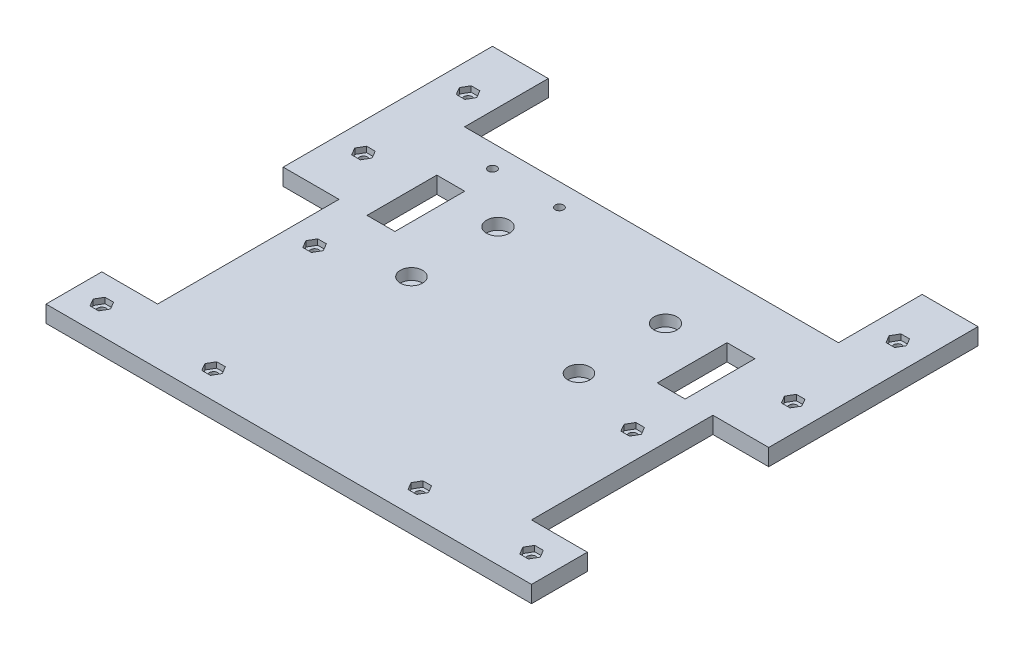
from build123d import *

# Parameters (mm, degrees)
SALIENTE_EXTRUIR1_DEPTH = 6
CORTAR_EXTRUIR1_DEPTH   = 2
CORTAR_EXTRUIR3_START   = -6
CORTAR_EXTRUIR3_DEPTH   = 2
CROQUIS5_R              = 1.5
CORTAR_EXTRUIR4_DEPTH   = 32
CORTAR_EXTRUIR5_DEPTH   = 2
CORTAR_EXTRUIR7_DEPTH   = 2
CROQUIS9_R              = 1.5
CORTAR_EXTRUIR8_DEPTH   = 2
CORTAR_EXTRUIR9_DEPTH   = 2
CORTAR_EXTRUIR10_DEPTH  = 2
CROQUIS12_R             = 1.5
CORTAR_EXTRUIR11_DEPTH  = 2
CROQUIS13_R             = 4.1
CORTAR_EXTRUIR12_DEPTH  = 4
CROQUIS14_R             = 1.5
CORTAR_EXTRUIR13_DEPTH  = 4
CROQUIS15_R             = 1.5
CROQUIS15_R_2           = 4
CORTAR_EXTRUIR14_DEPTH  = 4
CROQUIS16_R             = 1.5
CORTAR_EXTRUIR15_DEPTH  = 4
CROQUIS17_W             = 10
CROQUIS17_H             = 25
CORTAR_EXTRUIR16_DEPTH  = 11.3
CROQUIS18_R             = 1.5
CORTAR_EXTRUIR17_DEPTH  = 14


with BuildPart() as part:
    # Croquis1 → Saliente-Extruir1 (new body)
    with BuildSketch(Plane(origin=(0, 0, 0), x_dir=(1, 0, 0), z_dir=(0, 1, 0))):
        Polygon((0, 0), (174, 0), (174, 20), (154, 20), (154, 85), (174, 85), (174, 160), (154, 160), (154, 130), (20, 130), (20, 160), (0, 160), (0, 85), (20, 85), (20, 20), (0, 20), align=None)
    extrude(amount=SALIENTE_EXTRUIR1_DEPTH)

    # Croquis3 → Cortar-Extruir1 (cut)
    with BuildSketch(Plane(origin=(0, 6, 0), x_dir=(1, 0, 0), z_dir=(0, 1, 0))):
        Polygon((13.1, 141.25), (11.55, 143.934678752), (8.45, 143.934678752), (6.9, 141.25), (8.45, 138.565321248), (11.55, 138.565321248), align=None)
        Polygon((13.1, 103.75), (11.55, 106.434678752), (8.45, 106.434678752), (6.9, 103.75), (8.45, 101.065321248), (11.55, 101.065321248), align=None)
        Polygon((13.1, 10), (11.55, 12.684678752), (8.45, 12.684678752), (6.9, 10), (8.45, 7.315321248), (11.55, 7.315321248), align=None)
        Polygon((162.45, 101.065321248), (160.9, 103.75), (162.45, 106.434678752), (165.55, 106.434678752), (167.1, 103.75), (165.55, 101.065321248), align=None)
        Polygon((162.45, 138.565321248), (160.9, 141.25), (162.45, 143.934678752), (165.55, 143.934678752), (167.1, 141.25), (165.55, 138.565321248), align=None)
        Polygon((162.45, 7.315321248), (160.9, 10), (162.45, 12.684678752), (165.55, 12.684678752), (167.1, 10), (165.55, 7.315321248), align=None)
    extrude(amount=-CORTAR_EXTRUIR1_DEPTH, mode=Mode.SUBTRACT)

    # Croquis4 → Cortar-Extruir3 (cut)
    with BuildSketch(Plane(origin=(0, 6, 0), x_dir=(1, 0, 0), z_dir=(0, 1, 0)).offset(CORTAR_EXTRUIR3_START)):
        Polygon((6.9, 10), (8.45, 7.315321248), (11.55, 7.315321248), (13.1, 10), (11.55, 12.684678752), (8.45, 12.684678752), align=None)
        Polygon((6.9, 103.75), (8.45, 101.065321248), (11.55, 101.065321248), (13.1, 103.75), (11.55, 106.434678752), (8.45, 106.434678752), align=None)
        Polygon((6.9, 141.25), (8.45, 138.565321248), (11.55, 138.565321248), (13.1, 141.25), (11.55, 143.934678752), (8.45, 143.934678752), align=None)
        Polygon((162.45, 143.934678752), (160.9, 141.25), (162.45, 138.565321248), (165.55, 138.565321248), (167.1, 141.25), (165.55, 143.934678752), align=None)
        Polygon((162.45, 106.434678752), (160.9, 103.75), (162.45, 101.065321248), (165.55, 101.065321248), (167.1, 103.75), (165.55, 106.434678752), align=None)
        Polygon((162.45, 12.684678752), (160.9, 10), (162.45, 7.315321248), (165.55, 7.315321248), (167.1, 10), (165.55, 12.684678752), align=None)
    extrude(amount=CORTAR_EXTRUIR3_DEPTH, mode=Mode.SUBTRACT)

    # Croquis5 → Cortar-Extruir4 (cut)
    with BuildSketch(Plane(origin=(0, 6, 0), x_dir=(1, 0, 0), z_dir=(0, 1, 0))):
        with Locations(Location((10, 141.25, 0), (0, 0, 270))):
            Circle(CROQUIS5_R)
        with Locations(Location((10, 103.75, 0), (0, 0, 270))):
            Circle(CROQUIS5_R)
        with Locations(Location((10, 10, 0), (0, 0, 270))):
            Circle(CROQUIS5_R)
        with Locations(Location((164, 103.75, 0), (0, 0, 270))):
            Circle(CROQUIS5_R)
        with Locations(Location((164, 141.25, 0), (0, 0, 270))):
            Circle(CROQUIS5_R)
        with Locations(Location((164, 10, 0), (0, 0, 270))):
            Circle(CROQUIS5_R)
    extrude(amount=-CORTAR_EXTRUIR4_DEPTH, mode=Mode.SUBTRACT)

    # Croquis6 → Cortar-Extruir5 (cut)
    with BuildSketch(Plane(origin=(0, 6, 0), x_dir=(1, 0, 0), z_dir=(0, 1, 0))):
        Polygon((53.15, 10), (51.6, 12.684678752), (48.5, 12.684678752), (46.95, 10), (48.5, 7.315321248), (51.6, 7.315321248), align=None)
        Polygon((127.05, 10), (125.5, 12.684678752), (122.4, 12.684678752), (120.85, 10), (122.4, 7.315321248), (125.5, 7.315321248), align=None)
    extrude(amount=-CORTAR_EXTRUIR5_DEPTH, mode=Mode.SUBTRACT)

    # Croquis7 → Cortar-Extruir7 (cut)
    with BuildSketch(Plane.XZ):
        Polygon((53.15, -10), (51.6, -7.315321248), (48.5, -7.315321248), (46.95, -10), (48.5, -12.684678752), (51.6, -12.684678752), align=None)
        Polygon((127.05, -10), (125.5, -7.315321248), (122.4, -7.315321248), (120.85, -10), (122.4, -12.684678752), (125.5, -12.684678752), align=None)
    extrude(amount=-CORTAR_EXTRUIR7_DEPTH, mode=Mode.SUBTRACT)

    # Croquis9 → Cortar-Extruir8 (cut)
    with BuildSketch(Plane.XZ.offset(-2)):
        with Locations(Location((123.95, -10, 0), (0, 0, 270))):
            Circle(CROQUIS9_R)
        with Locations(Location((50.05, -10, 0), (0, 0, 270))):
            Circle(CROQUIS9_R)
    extrude(amount=-CORTAR_EXTRUIR8_DEPTH, mode=Mode.SUBTRACT)

    # Croquis10 → Cortar-Extruir9 (cut)
    with BuildSketch(Plane(origin=(0, 6, 0), x_dir=(1, 0, 0), z_dir=(0, 1, 0))):
        Polygon((33.1, 66.25), (31.55, 68.934678752), (28.45, 68.934678752), (26.9, 66.25), (28.45, 63.565321248), (31.55, 63.565321248), align=None)
        Polygon((147.1, 66.25), (145.55, 68.934678752), (142.45, 68.934678752), (140.9, 66.25), (142.45, 63.565321248), (145.55, 63.565321248), align=None)
    extrude(amount=-CORTAR_EXTRUIR9_DEPTH, mode=Mode.SUBTRACT)

    # Croquis11 → Cortar-Extruir10 (cut)
    with BuildSketch(Plane.XZ):
        Polygon((145.55, -63.565321248), (147.1, -66.25), (145.55, -68.934678752), (142.45, -68.934678752), (140.9, -66.25), (142.45, -63.565321248), align=None)
        Polygon((31.55, -63.565321248), (33.1, -66.25), (31.55, -68.934678752), (28.45, -68.934678752), (26.9, -66.25), (28.45, -63.565321248), align=None)
    extrude(amount=-CORTAR_EXTRUIR10_DEPTH, mode=Mode.SUBTRACT)

    # Croquis12 → Cortar-Extruir11 (cut)
    with BuildSketch(Plane.XZ.offset(-2)):
        with Locations(Location((144, -66.25, 0), (0, 0, 270))):
            Circle(CROQUIS12_R)
        with Locations(Location((30, -66.25, 0), (0, 0, 270))):
            Circle(CROQUIS12_R)
    extrude(amount=-CORTAR_EXTRUIR11_DEPTH, mode=Mode.SUBTRACT)

    # Croquis13 → Cortar-Extruir12 (cut)
    with BuildSketch(Plane(origin=(0, 6, 0), x_dir=(1, 0, 0), z_dir=(0, 1, 0))):
        with Locations(Location((117.01, 105, 0), (0, 0, 270))):
            Circle(CROQUIS13_R)
        with Locations(Location((56.99, 105, 0), (0, 0, 90))):
            Circle(CROQUIS13_R)
    extrude(amount=-CORTAR_EXTRUIR12_DEPTH, mode=Mode.SUBTRACT)

    # Croquis14 → Cortar-Extruir13 (cut)
    with BuildSketch(Plane(origin=(0, 2, 0), x_dir=(1, 0, 0), z_dir=(0, 1, 0))):
        with Locations(Location((117.01, 105, 0), (0, 0, 270))):
            Circle(CROQUIS14_R)
        with Locations(Location((56.99, 105, 0), (0, 0, 270))):
            Circle(CROQUIS14_R)
    extrude(amount=-CORTAR_EXTRUIR13_DEPTH, mode=Mode.SUBTRACT)

    # Croquis15 → Cortar-Extruir14 (cut)
    with BuildSketch(Plane(origin=(0, 6, 0), x_dir=(1, 0, 0), z_dir=(0, 1, 0))):
        with Locations(Location((56.99, 105, 0), (0, 0, 270))):
            Circle(CROQUIS15_R)
        with Locations(Location((56.99, 73.98, 0), (0, 0, 270))):
            Circle(CROQUIS15_R_2)
        with Locations(Location((117.01, 105, 0), (0, 0, 270))):
            Circle(CROQUIS15_R)
        with Locations(Location((117.01, 73.98, 0), (0, 0, 270))):
            Circle(CROQUIS15_R_2)
    extrude(amount=-CORTAR_EXTRUIR14_DEPTH, mode=Mode.SUBTRACT)

    # Croquis16 → Cortar-Extruir15 (cut)
    with BuildSketch(Plane(origin=(0, 2, 0), x_dir=(1, 0, 0), z_dir=(0, 1, 0))):
        with Locations(Location((56.99, 73.98, 0), (0, 0, 270))):
            Circle(CROQUIS16_R)
        with Locations(Location((117.01, 73.98, 0), (0, 0, 270))):
            Circle(CROQUIS16_R)
    extrude(amount=-CORTAR_EXTRUIR15_DEPTH, mode=Mode.SUBTRACT)

    # Croquis17 → Cortar-Extruir16 (cut)
    with BuildSketch(Plane(origin=(0, 6, 0), x_dir=(1, 0, 0), z_dir=(0, 1, 0))):
        with Locations((35, 97.543907688)):
            Rectangle(CROQUIS17_W, CROQUIS17_H)
        with Locations((139, 97.543907688)):
            Rectangle(CROQUIS17_W, CROQUIS17_H)
    extrude(amount=-CORTAR_EXTRUIR16_DEPTH, mode=Mode.SUBTRACT)

    # Croquis18 → Cortar-Extruir17 (cut)
    with BuildSketch(Plane(origin=(0, 6, 0), x_dir=(1, 0, 0), z_dir=(0, 1, 0))):
        with Locations(Location((38, 122, 0), (0, 0, 270))):
            Circle(CROQUIS18_R)
        with Locations(Location((62, 122, 0), (0, 0, 270))):
            Circle(CROQUIS18_R)
    extrude(amount=-CORTAR_EXTRUIR17_DEPTH, mode=Mode.SUBTRACT)


solid = part.part
